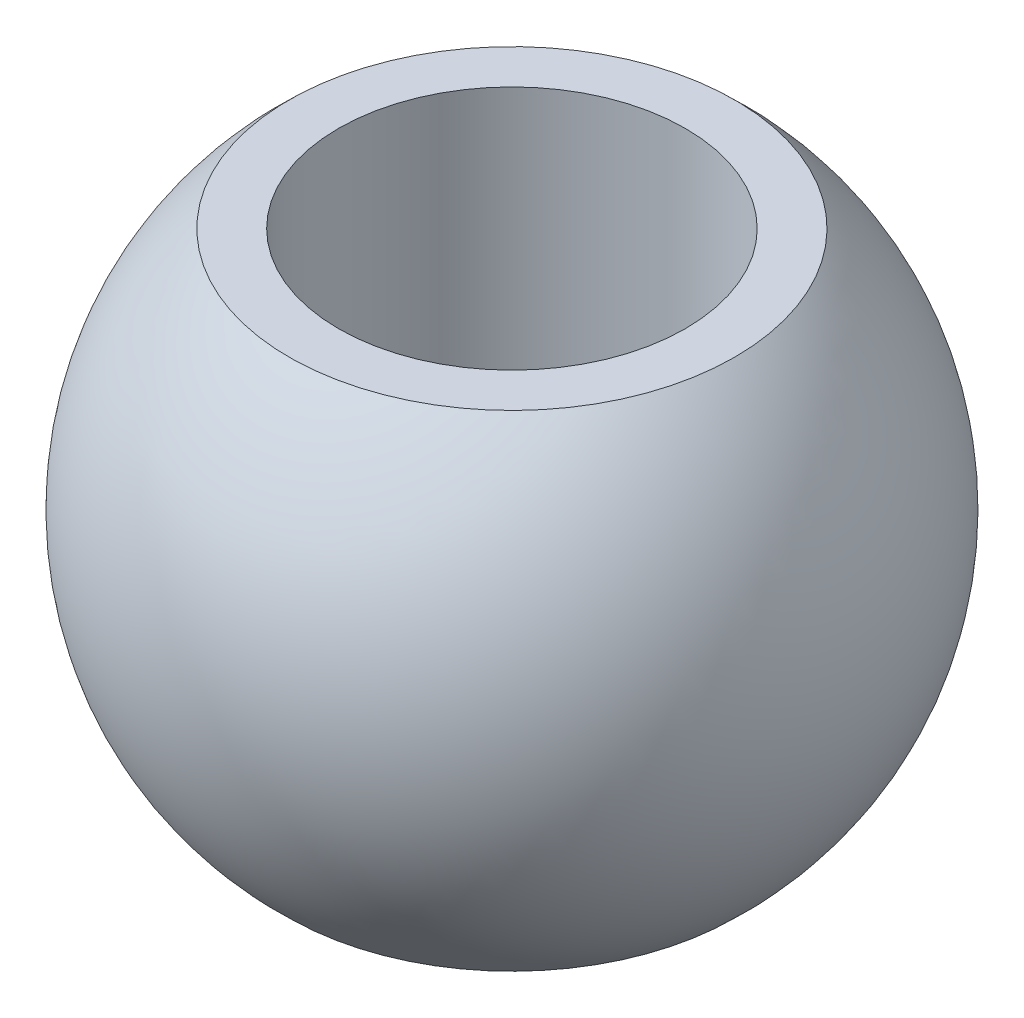
from build123d import *


with BuildPart() as part:
    # Sketch1 → Revolve1 (revolve)
    with BuildSketch(Plane(origin=(0, 0, 0), x_dir=(-1, 0, 0), z_dir=(0, 0, -1))):
        with BuildLine():
            Line((-6.422616289, -7), (-5, -7))
            Line((-5, -7), (-5, 7))
            Line((-5, 7), (-6.422616289, 7))
            ThreePointArc((-6.422616289, 7), (-9.5, 0), (-6.422616289, -7))
        make_face()
    revolve(axis=Axis((0, -7, 0), (0, 1, 0)))


solid = part.part
